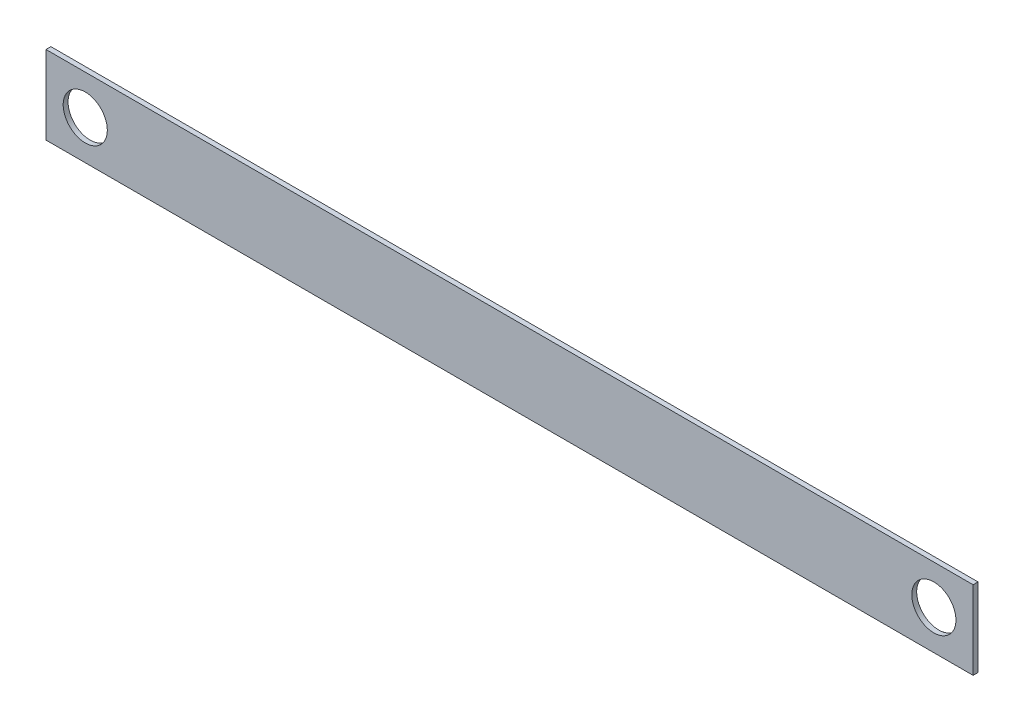
from build123d import *

# Parameters (mm, degrees)
SKETCH1_W           = 600
SKETCH1_H           = 50.8
SKETCH1_R           = 14.2875
BOSS_EXTRUDE1_DEPTH = 3.175


with BuildPart() as part:
    # Sketch1 → Boss-Extrude1 (new body)
    with BuildSketch(Plane.XY):
        Rectangle(SKETCH1_W, SKETCH1_H)
        with Locations((-274.6, 0)):
            Circle(SKETCH1_R, mode=Mode.SUBTRACT)
        with Locations((274.6, 0)):
            Circle(SKETCH1_R, mode=Mode.SUBTRACT)
    extrude(amount=BOSS_EXTRUDE1_DEPTH)


solid = part.part
